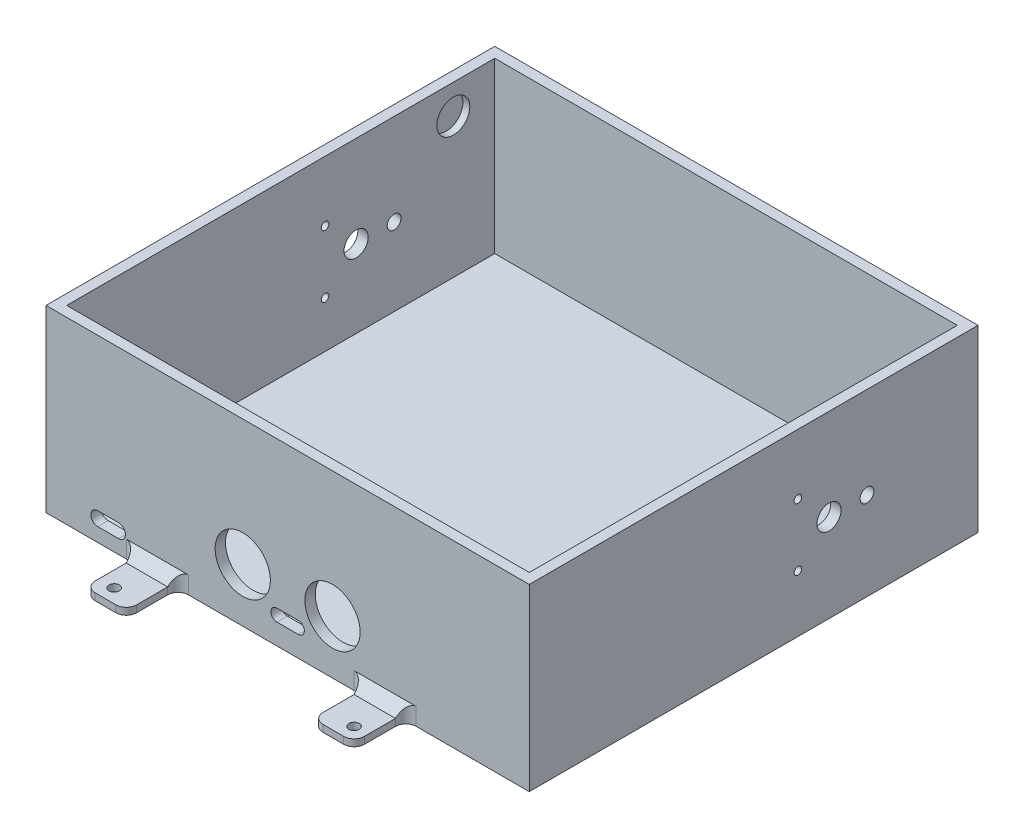
from build123d import *

# Parameters (mm, degrees)
SKETCH1_W           = 140
SKETCH1_H           = 130
BOSS_EXTRUDE1_DEPTH = 52
SHELL1_T            = -3
SKETCH2_R           = 3.5
SKETCH2_R_2         = 2
SKETCH2_R_3         = 1.1
CUT_EXTRUDE1_DEPTH  = 137
SKETCH3_R           = 1.1
CUT_EXTRUDE2_DEPTH  = 3
CUT_EXTRUDE4_DEPTH  = 3
SKETCH7_R           = 4.775
CUT_EXTRUDE5_DEPTH  = 2
CIRPATTERN5_COUNT   = 2
SKETCH8_W           = 12
SKETCH8_H           = 15
BOSS_EXTRUDE2_DEPTH = 2
SKETCH11_R          = 1.5
CUT_EXTRUDE7_DEPTH  = 118.473401245
FILLET1_R           = 3
FILLET2_R           = 3
CHAMFER1_SIZE       = 3
SKETCH12_R          = 8
CUT_EXTRUDE8_DEPTH  = 10


with BuildPart() as part:
    # Sketch1 → Boss-Extrude1 (new body)
    with BuildSketch(Plane(origin=(0, 0, 0), x_dir=(1, 0, 0), z_dir=(0, 1, 0))):
        Rectangle(SKETCH1_W, SKETCH1_H)
    extrude(amount=BOSS_EXTRUDE1_DEPTH)

    # Shell1
    shell1_openings = [part.faces().sort_by_distance(p)[0] for p in [
        (0, 52, 0),
    ]]
    offset(amount=SHELL1_T, openings=shell1_openings, kind=Kind.INTERSECTION)

    # Sketch2 → Cut-Extrude1 (cut)
    with BuildSketch(Plane(origin=(70, 0, 0), x_dir=(0, 0, -1), z_dir=(1, 0, 0))):
        with Locations((21.837588157, 25.5)):
            Circle(SKETCH2_R)
        with Locations((32.837588157, 25.5)):
            Circle(SKETCH2_R_2)
        with Locations((12.837588157, 34.5)):
            Circle(SKETCH2_R_3)
        with Locations((12.837588157, 16.5)):
            Circle(SKETCH2_R_3)
    cut_extrude1 = extrude(amount=-CUT_EXTRUDE1_DEPTH, mode=Mode.SUBTRACT)

    # Mirror1: Cut-Extrude1 across plane
    add(cut_extrude1.mirror(Plane(origin=(0, 0, 0), x_dir=(0, 0, 1), z_dir=(1, 0, 0))), mode=Mode.SUBTRACT)

    # Sketch3 → Cut-Extrude2 (cut)
    with BuildSketch(Plane(origin=(0, 3, 0), x_dir=(1, 0, 0), z_dir=(0, 1, 0))):
        with Locations(Location((-7, -59, 0), (0, 0, 270))):
            Circle(SKETCH3_R)
        with Locations(Location((7, -59, 0), (0, 0, 270))):
            Circle(SKETCH3_R)
    extrude(amount=-CUT_EXTRUDE2_DEPTH, mode=Mode.SUBTRACT)

    # Sketch6 → Cut-Extrude4 (cut)
    with BuildSketch(Plane(origin=(0, 0, 62), x_dir=(-1, 0, 0), z_dir=(0, 0, -1))):
        with BuildLine():
            Line((55, 4), (49, 4))
            ThreePointArc((49, 4), (47, 6), (49, 8))
            Line((49, 8), (55, 8))
            ThreePointArc((55, 8), (57, 6), (55, 4))
        make_face()
    extrude(amount=-CUT_EXTRUDE4_DEPTH, mode=Mode.SUBTRACT)

    # Sketch7 → Cut-Extrude5 (cut)
    with BuildSketch(Plane(origin=(-67, 0, 0), x_dir=(0, 0, -1), z_dir=(1, 0, 0))):
        with Locations((50, 43.5)):
            Circle(SKETCH7_R)
    cut_extrude5 = extrude(amount=-CUT_EXTRUDE5_DEPTH, mode=Mode.SUBTRACT)

    # CirPattern5: Cut-Extrude5 ×2 about axis
    cirpattern5_axis = Axis((0, 54.6, 0), (0, -1, 0))
    for i in range(1, CIRPATTERN5_COUNT):
        add(cut_extrude5.rotate(cirpattern5_axis, i * 360 / CIRPATTERN5_COUNT), mode=Mode.SUBTRACT)

    # Sketch8 → Boss-Extrude2 (add)
    with BuildSketch(Plane(origin=(0, 0, 0), x_dir=(1, 0, 0), z_dir=(0, 1, 0))):
        with Locations((-37.75, -72.5)):
            Rectangle(SKETCH8_W, SKETCH8_H)
        with Locations((28.25, -72.5)):
            Rectangle(SKETCH8_W, SKETCH8_H)
    extrude(amount=BOSS_EXTRUDE2_DEPTH)

    # Sketch11 → Cut-Extrude7 (cut, through all)
    with BuildSketch(Plane(origin=(0, 2, 0), x_dir=(1, 0, 0), z_dir=(0, 1, 0))):
        with Locations(Location((-39.25, -76, 0), (0, 0, 270))):
            Circle(SKETCH11_R)
        with Locations(Location((30.25, -76, 0), (0, 0, 270))):
            Circle(SKETCH11_R)
    extrude(amount=-CUT_EXTRUDE7_DEPTH, mode=Mode.SUBTRACT)

    # Fillet1
    fillet1_edges = [part.edges().sort_by_distance(p)[0] for p in [
        (-43.75, 1, 65),
        (-43.75, 1, 80),
        (34.25, 1, 80),
        (34.25, 1, 65),
    ]]
    fillet(fillet1_edges, radius=FILLET1_R)

    # Fillet2
    fillet2_edges = [part.edges().sort_by_distance(p)[0] for p in [
        (-31.75, 1, 80),
        (-31.75, 1, 65),
        (22.25, 1, 80),
        (22.25, 1, 65),
    ]]
    fillet(fillet2_edges, radius=FILLET2_R)

    # Chamfer1
    chamfer1_edges = [part.edges().sort_by_distance(p)[0] for p in [
        (28.25, 2, 65),
        (-37.75, 2, 65),
    ]]
    chamfer(chamfer1_edges, length=CHAMFER1_SIZE)

    # Sketch12 → Cut-Extrude8 (cut)
    with BuildSketch(Plane.XY.offset(65)):
        with Locations((-13, 15.5)):
            Circle(SKETCH12_R)
        with Locations((13, 15.5)):
            Circle(SKETCH12_R)
        with BuildLine():
            Line((-3.1, 9.5), (3.1, 9.5))
            ThreePointArc((3.1, 9.5), (4.85, 7.75), (3.1, 6))
            Line((3.1, 6), (-3.1, 6))
            ThreePointArc((-3.1, 6), (-4.85, 7.75), (-3.1, 9.5))
        make_face()
    extrude(amount=-CUT_EXTRUDE8_DEPTH, mode=Mode.SUBTRACT)


solid = part.part
